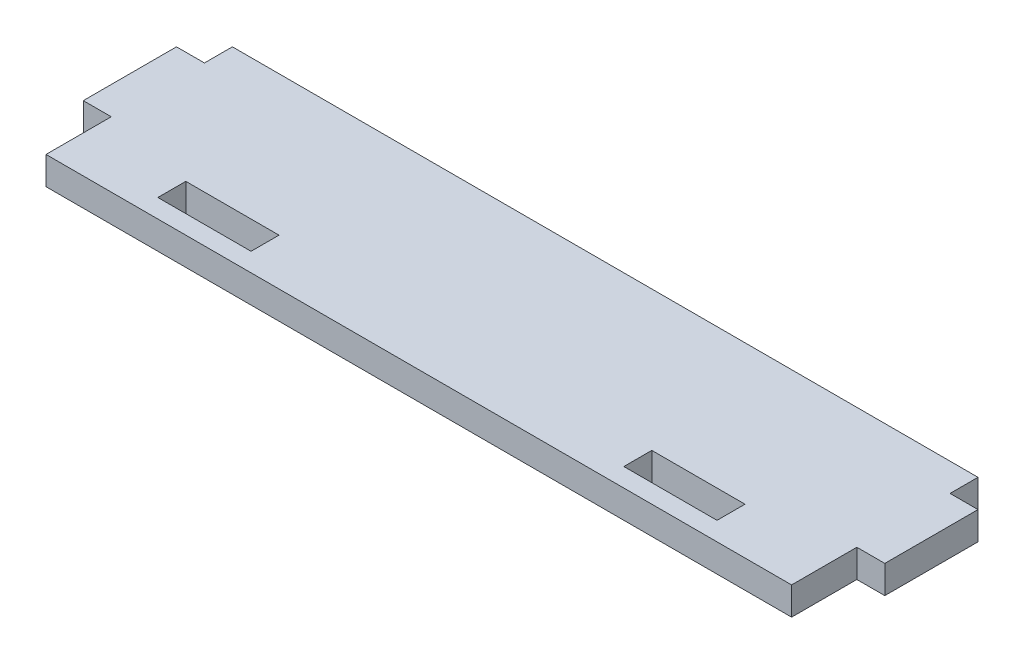
from build123d import *

# Parameters (mm, degrees)
SKETCH1_W           = 10
SKETCH1_H           = 3
BOSS_EXTRUDE1_DEPTH = 3


with BuildPart() as part:
    # Sketch1 → Boss-Extrude1 (new body)
    with BuildSketch(Plane(origin=(0, 0, 0), x_dir=(1, 0, 0), z_dir=(0, 1, 0))):
        Polygon((0, 17), (0, 20), (80, 20), (80, 17), (83, 17), (83, 7), (80, 7), (80, 0), (0, 0), (0, 7), (-3, 7), (-3, 17), align=None)
        with Locations((15, 3.5)):
            Rectangle(SKETCH1_W, SKETCH1_H, mode=Mode.SUBTRACT)
        with Locations((65, 3.5)):
            Rectangle(SKETCH1_W, SKETCH1_H, mode=Mode.SUBTRACT)
    extrude(amount=BOSS_EXTRUDE1_DEPTH)


solid = part.part
